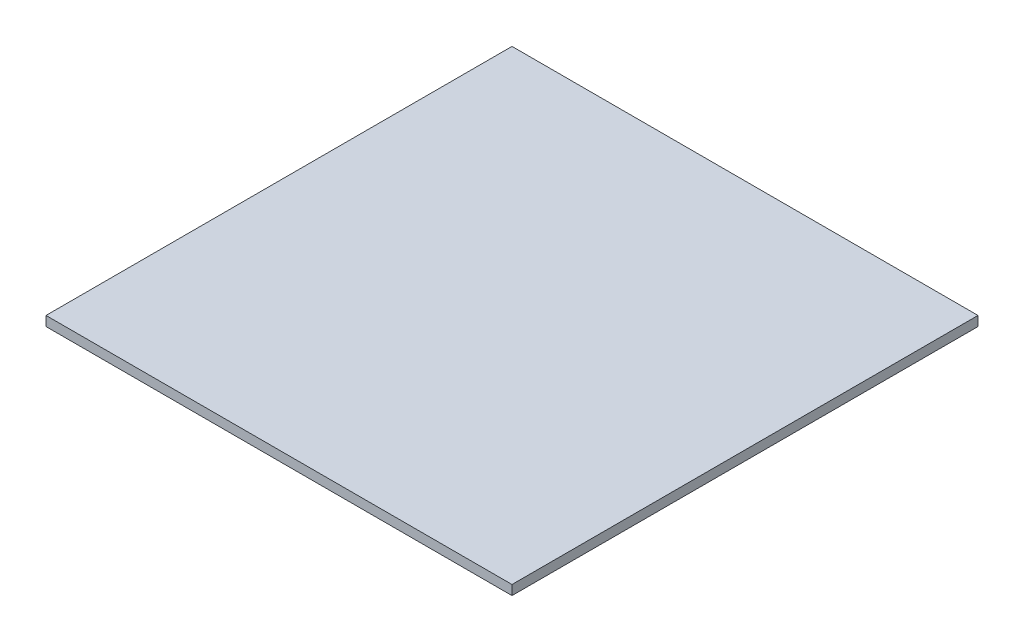
from build123d import *

# Parameters (mm, degrees)
CROQUIS_PANEL_W = 145
CROQUIS_PANEL_H = 145
PANEL_DEPTH     = 3


with BuildPart() as part:
    # Croquis_panel → Panel (new body)
    with BuildSketch(Plane(origin=(0, 0, 0), x_dir=(1, 0, 0), z_dir=(0, 1, 0))):
        Rectangle(CROQUIS_PANEL_W, CROQUIS_PANEL_H)
    extrude(amount=PANEL_DEPTH)


solid = part.part
